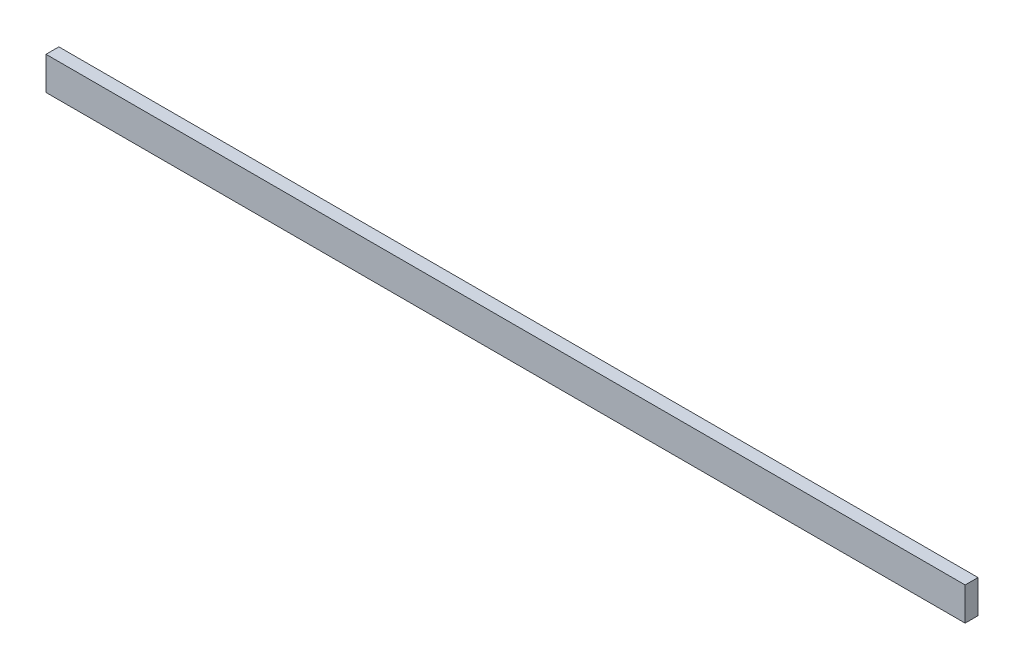
from build123d import *

# Parameters (mm, degrees)
SKETCH1_W           = 635
SKETCH1_H           = 22.86
BOSS_EXTRUDE1_DEPTH = 8.89


with BuildPart() as part:
    # Sketch1 → Boss-Extrude1 (new body)
    with BuildSketch(Plane.XY):
        with Locations((278.578389349, 13.054521988)):
            Rectangle(SKETCH1_W, SKETCH1_H)
    extrude(amount=BOSS_EXTRUDE1_DEPTH)


solid = part.part
